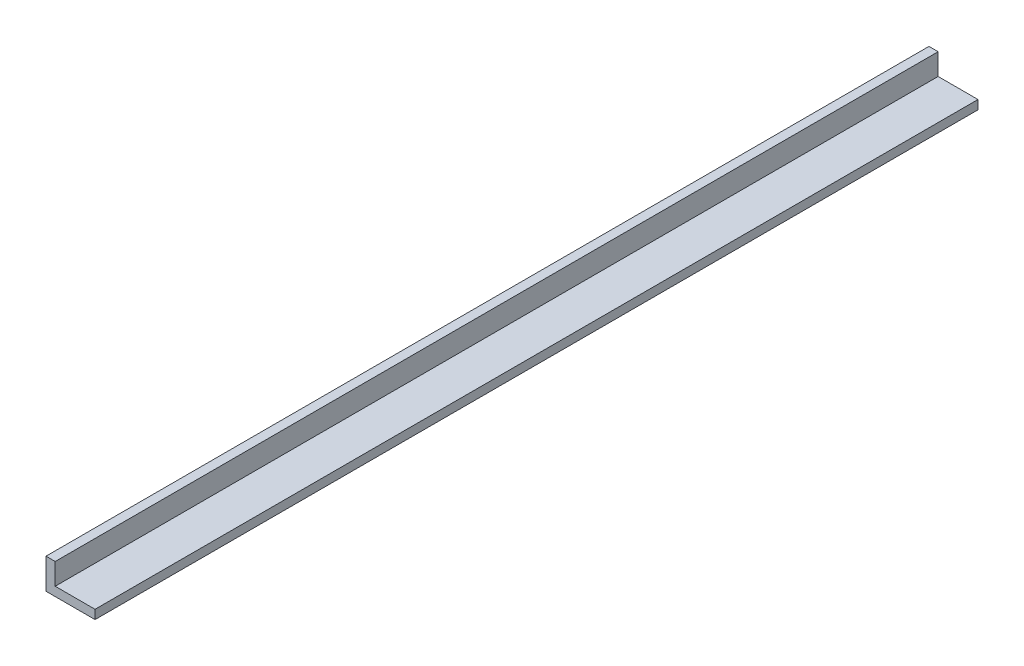
from build123d import *

# Parameters (mm, degrees)
BOSS_EXTRUDE1_DEPTH = 3657.6


with BuildPart() as part:
    # Sketch2 → Boss-Extrude1 (new body)
    with BuildSketch(Plane.XY):
        Polygon((-102.933140418, -18.800036172), (100.266859582, -18.800036172), (100.266859582, 18.313058159), (-64.845924489, 18.313058159), (-64.845924489, 107.213058159), (-102.933140418, 107.213058159), (-102.933140418, 19.299963828), align=None)
    extrude(amount=BOSS_EXTRUDE1_DEPTH)


solid = part.part
